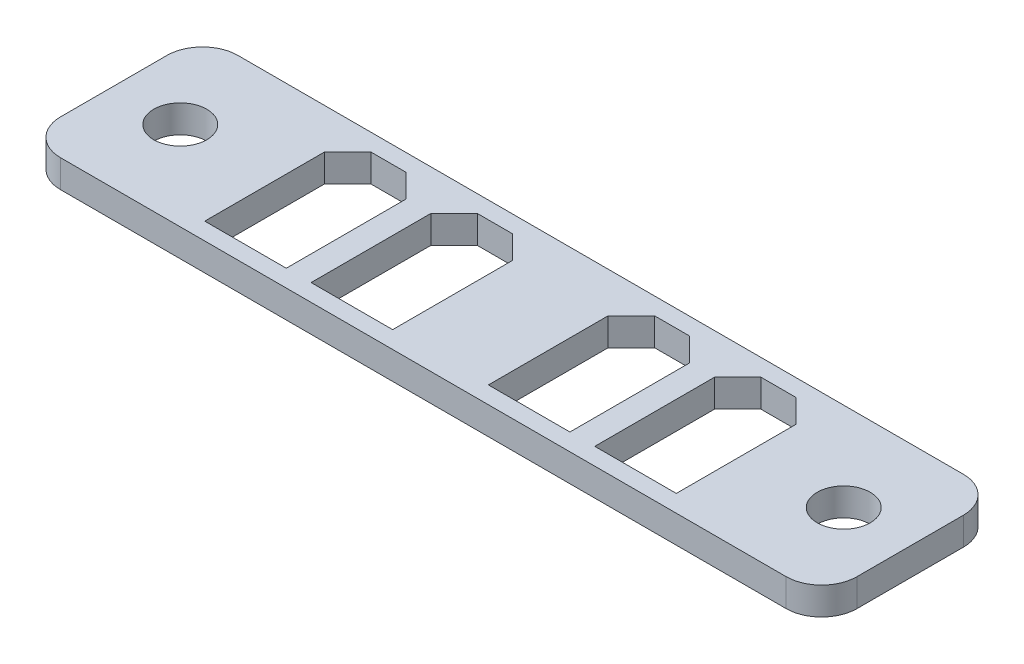
from build123d import *

# Parameters (mm, degrees)
SKETCH1_W           = 57.05
SKETCH1_H           = 12.7
SKETCH1_R           = 1.89865
BOSS_EXTRUDE1_DEPTH = 1.984375
CUT_EXTRUDE1_REACH  = 60.48
FILLET1_R           = 2.54


with BuildPart() as part:
    # Sketch1 → Boss-Extrude1 (new body)
    with BuildSketch(Plane(origin=(0, 0, 0), x_dir=(1, 0, 0), z_dir=(0, 1, 0))):
        with Locations((28.525, 6.35)):
            Rectangle(SKETCH1_W, SKETCH1_H)
        with Locations(Location((52.2875, 6.35, 0), (0, 0, 270))):
            Circle(SKETCH1_R, mode=Mode.SUBTRACT)
        with Locations(Location((4.7625, 6.35, 0), (0, 0, 270))):
            Circle(SKETCH1_R, mode=Mode.SUBTRACT)
    extrude(amount=BOSS_EXTRUDE1_DEPTH)

    # Sketch2 → Cut-Extrude1 (cut, up to next)
    with BuildSketch(Plane(origin=(0, 1.984375, 0), x_dir=(1, 0, 0), z_dir=(0, 1, 0)), mode=Mode.PRIVATE) as cut_extrude1_sk1:
        Polygon((17.475, 1.23), (11.635, 1.23), (11.635, 9.808717093), (13.29671726, 11.47), (15.81328274, 11.47), (17.475, 9.808717093), align=None)
    cut_extrude1_tool1 = extrude(cut_extrude1_sk1.sketch, amount=-CUT_EXTRUDE1_REACH, mode=Mode.PRIVATE) & part.part
    # Sketch2 → Cut-Extrude1 (cut, up to next)
    with BuildSketch(Plane(origin=(0, 1.984375, 0), x_dir=(1, 0, 0), z_dir=(0, 1, 0)), mode=Mode.PRIVATE) as cut_extrude1_sk2:
        Polygon((45.415, 1.23), (39.575, 1.23), (39.575, 9.808717093), (41.23671726, 11.47), (43.75328274, 11.47), (45.415, 9.808717093), align=None)
    cut_extrude1_tool2 = extrude(cut_extrude1_sk2.sketch, amount=-CUT_EXTRUDE1_REACH, mode=Mode.PRIVATE) & part.part
    # Sketch2 → Cut-Extrude1 (cut, up to next)
    with BuildSketch(Plane(origin=(0, 1.984375, 0), x_dir=(1, 0, 0), z_dir=(0, 1, 0)), mode=Mode.PRIVATE) as cut_extrude1_sk3:
        Polygon((25.095, 1.23), (19.255, 1.23), (19.255, 9.808717093), (20.91671726, 11.47), (23.43328274, 11.47), (25.095, 9.808717093), align=None)
    cut_extrude1_tool3 = extrude(cut_extrude1_sk3.sketch, amount=-CUT_EXTRUDE1_REACH, mode=Mode.PRIVATE) & part.part
    # Sketch2 → Cut-Extrude1 (cut, up to next)
    with BuildSketch(Plane(origin=(0, 1.984375, 0), x_dir=(1, 0, 0), z_dir=(0, 1, 0)), mode=Mode.PRIVATE) as cut_extrude1_sk4:
        Polygon((37.795, 1.23), (31.955, 1.23), (31.955, 9.808717093), (33.61671726, 11.47), (36.13328274, 11.47), (37.795, 9.808717093), align=None)
    cut_extrude1_tool4 = extrude(cut_extrude1_sk4.sketch, amount=-CUT_EXTRUDE1_REACH, mode=Mode.PRIVATE) & part.part
    add(cut_extrude1_tool1.solids().sort_by_distance((14.555, 1.984375, -6.12901))[0], mode=Mode.SUBTRACT)
    add(cut_extrude1_tool2.solids().sort_by_distance((42.495, 1.984375, -6.12901))[0], mode=Mode.SUBTRACT)
    add(cut_extrude1_tool3.solids().sort_by_distance((22.175, 1.984375, -6.12901))[0], mode=Mode.SUBTRACT)
    add(cut_extrude1_tool4.solids().sort_by_distance((34.875, 1.984375, -6.12901))[0], mode=Mode.SUBTRACT)

    # Fillet1
    fillet1_edges = [part.edges().sort_by_distance(p)[0] for p in [
        (0, 0.9921875, -12.7),
        (57.05, 0.9921875, -12.7),
        (57.05, 0.9921875, 0),
        (0, 0.9921875, 0),
    ]]
    fillet(fillet1_edges, radius=FILLET1_R)


solid = part.part
